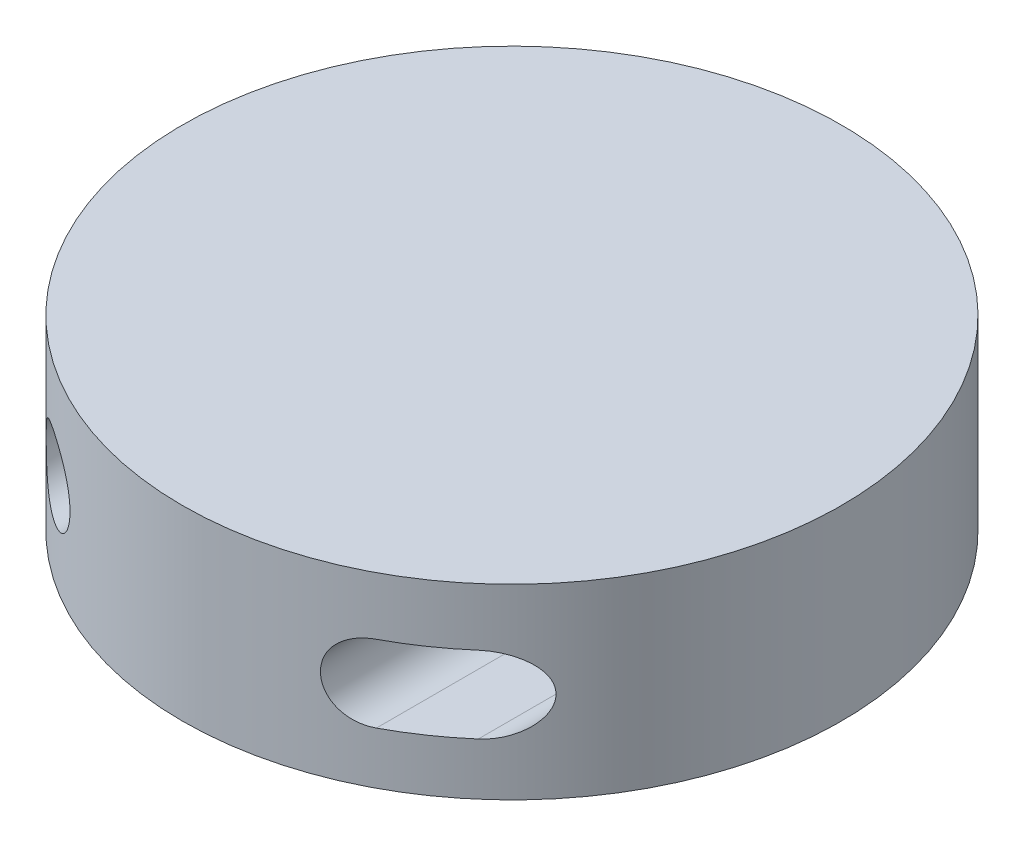
from build123d import *

# Parameters (mm, degrees)
SKETCH1_R           = 30
BOSS_EXTRUDE1_DEPTH = 17
SKETCH2_R           = 3.5
CUT_EXTRUDE1_DEPTH  = 16.5
SKETCH3_R           = 10
BOSS_EXTRUDE2_DEPTH = 1


with BuildPart() as part:
    # Sketch1 → Boss-Extrude1 (new body)
    with BuildSketch(Plane(origin=(0, 0, 0), x_dir=(1, 0, 0), z_dir=(0, 1, 0))):
        with Locations(Location((0, 0, 0), (0, 0, 270))):
            Circle(SKETCH1_R)
    extrude(amount=BOSS_EXTRUDE1_DEPTH)

    # Sketch2 → Cut-Extrude1 (cut)
    with BuildSketch(Plane.XY.offset(30)):
        with Locations((-16.875, 8.25)):
            Circle(SKETCH2_R)
        with BuildLine():
            Line((14.125, 11.75), (19.625, 11.75))
            ThreePointArc((19.625, 11.75), (23.125, 8.25), (19.625, 4.75))
            Line((19.625, 4.75), (14.125, 4.75))
            ThreePointArc((14.125, 4.75), (10.625, 8.25), (14.125, 11.75))
        make_face()
    extrude(amount=-CUT_EXTRUDE1_DEPTH, mode=Mode.SUBTRACT)

    # Sketch3 → Boss-Extrude2 (add)
    with BuildSketch(Plane.XZ):
        with Locations(Location((0, 0, 0), (0, 0, 270))):
            Circle(SKETCH3_R)
    extrude(amount=BOSS_EXTRUDE2_DEPTH)


solid = part.part
